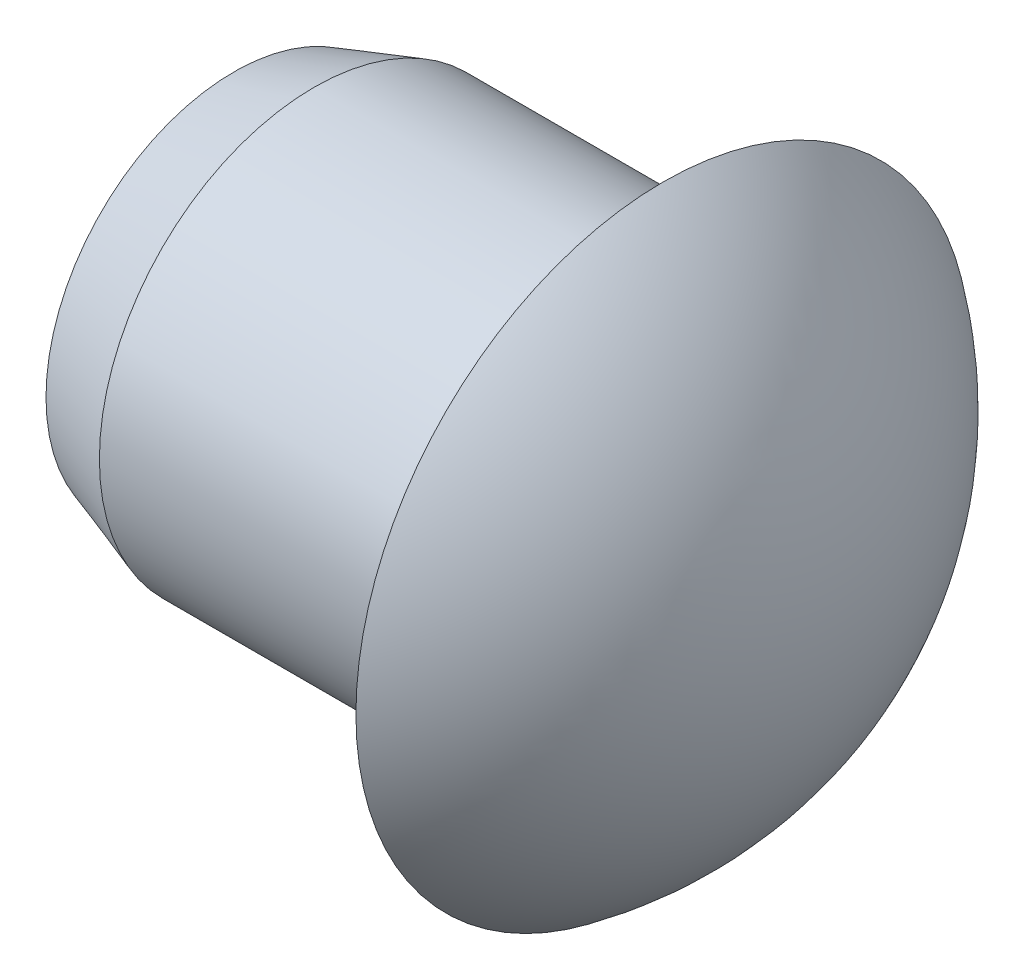
from build123d import *


with BuildPart() as part:
    # 草图1 → 旋转1 (revolve)
    with BuildSketch(Plane.XY, mode=Mode.PRIVATE) as revolve_1_sk:
        with BuildLine():
            Line((0, 2.5), (0, 3.5))
            Line((0, 3.5), (1.494559039, 4))
            Line((1.494559039, 4), (8, 4))
            Line((8, 4), (8, 5.726362631))
            ThreePointArc((8, 5.726362631), (10.173497708, 3.222185879), (10.956128949, 0))
            Line((10.956128949, 0), (8, 0))
            Line((8, 0), (8, 2.5))
            Line((8, 2.5), (0, 2.5))
        make_face()
    revolve(revolve_1_sk.sketch.rotate(Axis((0, 0, 0), (1, 0, 0)), 90), axis=Axis((0, 0, 0), (1, 0, 0)))


solid = part.part
